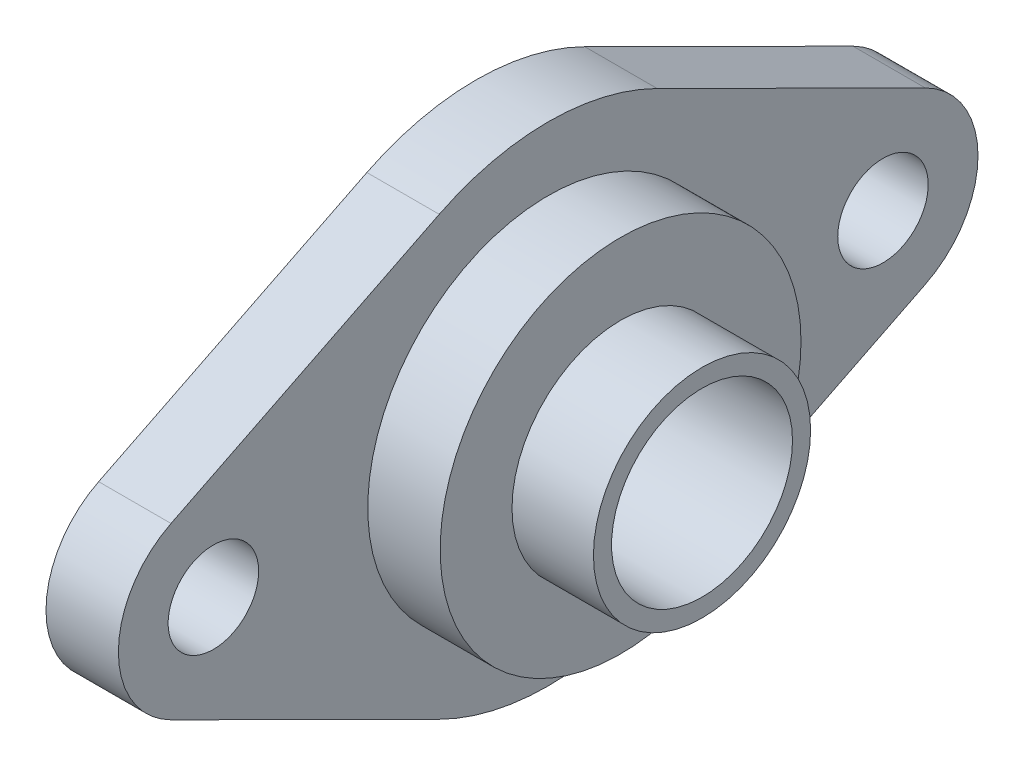
from build123d import *

# Parameters (mm, degrees)
SKETCH1_R           = 2.5
BOSS_EXTRUDE1_DEPTH = 4
SKETCH2_R           = 9.969747688
BOSS_EXTRUDE2_DEPTH = 4
SKETCH3_R           = 6
BOSS_EXTRUDE3_DEPTH = 4.5
SKETCH4_R           = 5
CUT_EXTRUDE1_DEPTH  = 31.042677977


with BuildPart() as part:
    # Sketch1 → Boss-Extrude1 (new body)
    with BuildSketch(Plane(origin=(0, 0, 0), x_dir=(0, 0, -1), z_dir=(1, 0, 0))):
        with BuildLine():
            Line((-20.841216216, 4.699064442), (-6.02027027, 12.083308565))
            ThreePointArc((-6.02027027, 12.083308565), (0, 13.5), (6.02027027, 12.083308565))
            Line((6.02027027, 12.083308565), (20.841216216, 4.699064442))
            ThreePointArc((20.841216216, 4.699064442), (23.75, 0), (20.841216216, -4.699064442))
            Line((20.841216216, -4.699064442), (6.02027027, -12.083308565))
            ThreePointArc((6.02027027, -12.083308565), (0, -13.5), (-6.02027027, -12.083308565))
            Line((-6.02027027, -12.083308565), (-20.841216216, -4.699064442))
            ThreePointArc((-20.841216216, -4.699064442), (-23.75, 0), (-20.841216216, 4.699064442))
        make_face()
        with Locations((-18.5, 0)):
            Circle(SKETCH1_R, mode=Mode.SUBTRACT)
        with Locations(Location((18.5, 0, 0), (0, 0, 180))):
            Circle(SKETCH1_R, mode=Mode.SUBTRACT)
    extrude(amount=BOSS_EXTRUDE1_DEPTH)

    # Sketch2 → Boss-Extrude2 (add)
    with BuildSketch(Plane(origin=(4, 0, 0), x_dir=(0, 0, -1), z_dir=(1, 0, 0))):
        Circle(SKETCH2_R)
    extrude(amount=BOSS_EXTRUDE2_DEPTH)

    # Sketch3 → Boss-Extrude3 (add)
    with BuildSketch(Plane(origin=(8, 0, 0), x_dir=(0, 0, -1), z_dir=(1, 0, 0))):
        Circle(SKETCH3_R)
    extrude(amount=BOSS_EXTRUDE3_DEPTH)

    # Sketch4 → Cut-Extrude1 (cut, through all)
    with BuildSketch(Plane(origin=(12.5, 0, 0), x_dir=(0, 0, -1), z_dir=(1, 0, 0))):
        Circle(SKETCH4_R)
    extrude(amount=-CUT_EXTRUDE1_DEPTH, mode=Mode.SUBTRACT)


solid = part.part
